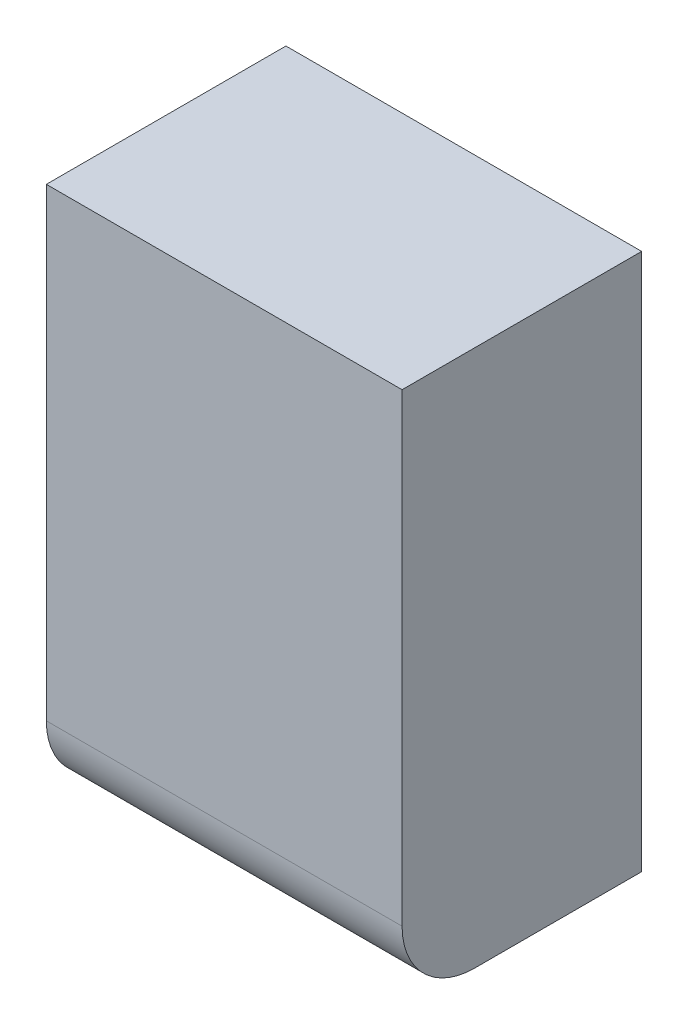
from build123d import *

# Parameters (mm, degrees)
SKETCH1_W           = 4.9
SKETCH1_H           = 7.4
BOSS_EXTRUDE1_DEPTH = 3.3
FILLET1_R           = 1


with BuildPart() as part:
    # Sketch1 → Boss-Extrude1 (new body)
    with BuildSketch(Plane.XY):
        with Locations((-2.45, -3.7)):
            Rectangle(SKETCH1_W, SKETCH1_H)
    extrude(amount=BOSS_EXTRUDE1_DEPTH)

    # Fillet1
    fillet1_edges = [part.edges().sort_by_distance(p)[0] for p in [
        (-2.45, -7.4, 3.3),
    ]]
    fillet(fillet1_edges, radius=FILLET1_R)


solid = part.part
